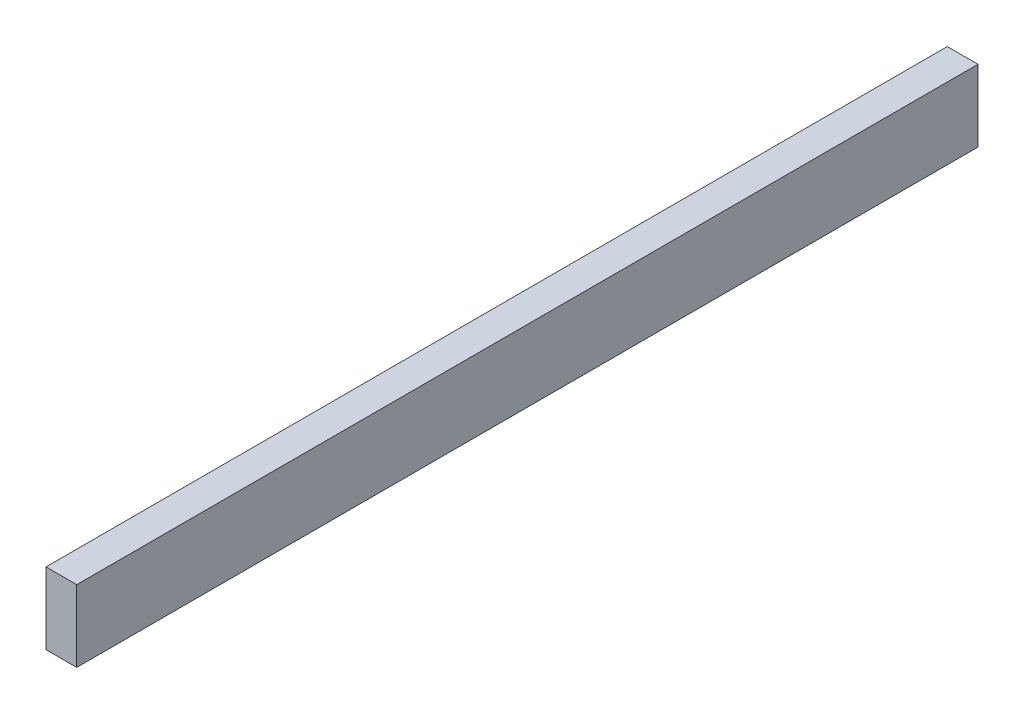
from build123d import *

# Parameters (mm, degrees)
SKETCH1_W           = 1117.6
SKETCH1_H           = 88.9
BOSS_EXTRUDE1_DEPTH = 38.1


with BuildPart() as part:
    # Sketch1 → Boss-Extrude1 (new body)
    with BuildSketch(Plane(origin=(0, 0, 0), x_dir=(0, 0, -1), z_dir=(1, 0, 0))):
        Rectangle(SKETCH1_W, SKETCH1_H)
    extrude(amount=BOSS_EXTRUDE1_DEPTH)


solid = part.part
